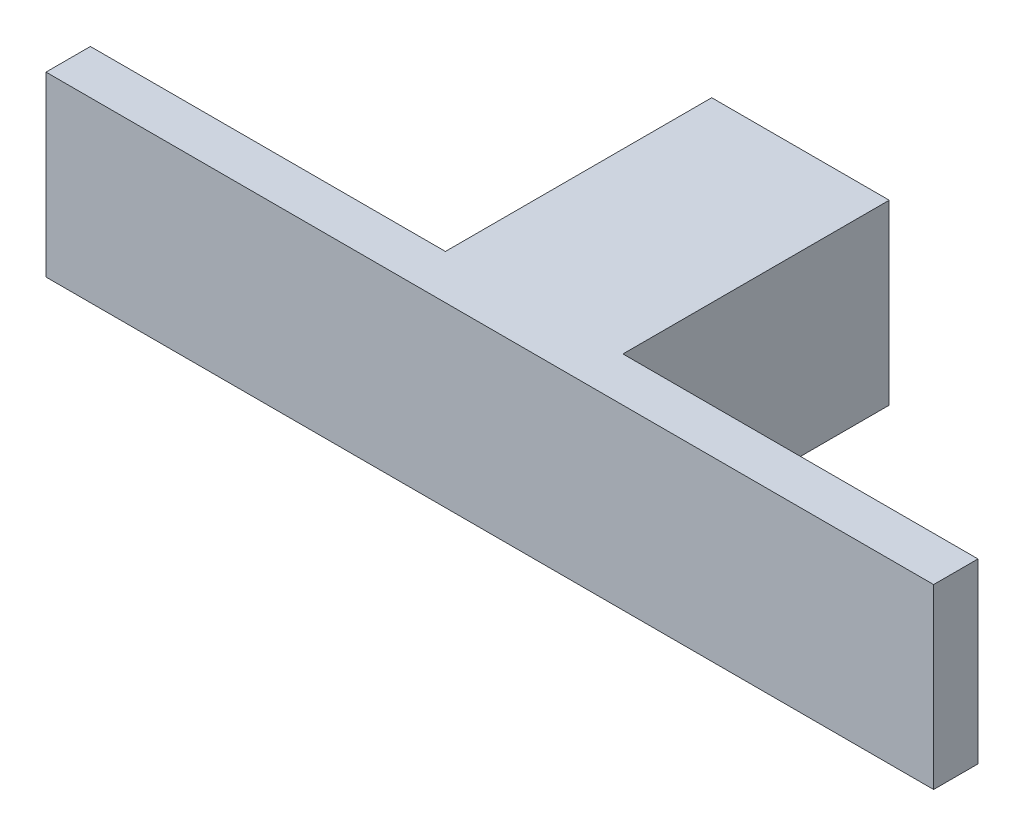
from build123d import *

# Parameters (mm, degrees)
BOSS_EXTRUDE1_DEPTH = 20


with BuildPart() as part:
    # Sketch2 → Boss-Extrude1 (new body)
    with BuildSketch(Plane(origin=(0, 0, 0), x_dir=(1, 0, 0), z_dir=(0, 1, 0))):
        Polygon((50, -35), (-50, -35), (-50, -30), (-10, -30), (-10, 0), (10, 0), (10, -30), (50, -30), align=None)
    extrude(amount=BOSS_EXTRUDE1_DEPTH)


solid = part.part
